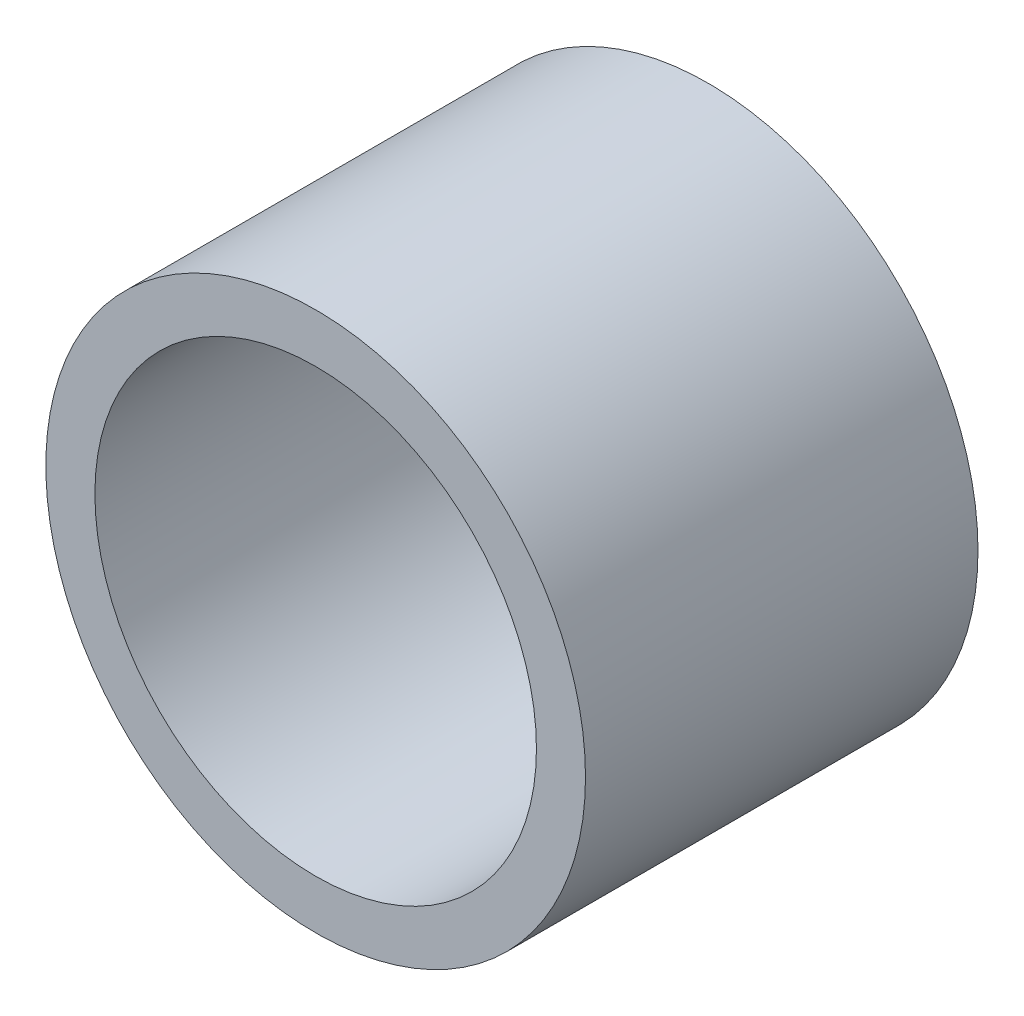
from build123d import *

# Parameters (mm, degrees)
SKETCH_1_R      = 5.5
SKETCH_1_R_2    = 4.5
EXTRUDE_1_DEPTH = 8


with BuildPart() as part:
    # 草图1 → 凸台-拉伸1 (new body)
    with BuildSketch(Plane.XY):
        Circle(SKETCH_1_R)
        Circle(SKETCH_1_R_2, mode=Mode.SUBTRACT)
    extrude(amount=EXTRUDE_1_DEPTH)


solid = part.part
